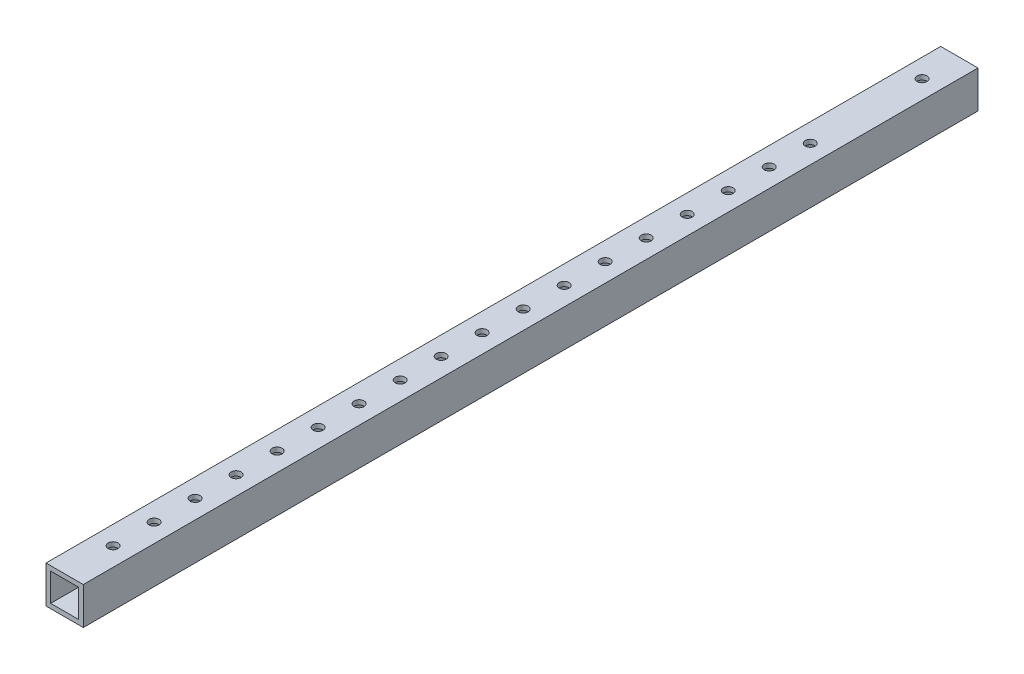
from build123d import *

# Parameters (mm, degrees)
SKETCH1_W               = 25.4
SKETCH1_H               = 25.4
SKETCH1_W_2             = 19.05
SKETCH1_H_2             = 19.05
EXTRUDE1_DEPTH          = 609.6
F_1_4_CLEARANCE_HOLE1_D = 6.7564
F_1_4_CLEARANCE_HOLE2_D = 6.7564
LPATTERN1_COUNT         = 18
LPATTERN1_PITCH         = 27.94


with BuildPart() as part:
    # Sketch1 → Extrude1 (new body)
    with BuildSketch(Plane.XY):
        Rectangle(SKETCH1_W, SKETCH1_H)
        Rectangle(SKETCH1_W_2, SKETCH1_H_2, mode=Mode.SUBTRACT)
    extrude(amount=-EXTRUDE1_DEPTH)

    # 1/4 Clearance Hole1 (through all)
    with Locations(Plane(origin=(0, 12.7, 0), x_dir=(-1, 0, 0), z_dir=(0, 1, 0))):
        with Locations((0, -584.2)):
            Hole(F_1_4_CLEARANCE_HOLE1_D / 2)

    # 1/4 Clearance Hole2 (through all)
    with Locations(Plane(origin=(0, 12.7, 0), x_dir=(-1, 0, 0), z_dir=(0, 1, 0))):
        with Locations((0, -508)):
            f_1_4_clearance_hole2 = Hole(F_1_4_CLEARANCE_HOLE2_D / 2)

    # LPattern1: 1/4 Clearance Hole2 ×18
    with Locations(*[(0, 0, i * LPATTERN1_PITCH) for i in range(1, LPATTERN1_COUNT)]):
        add(f_1_4_clearance_hole2, mode=Mode.SUBTRACT)


solid = part.part
